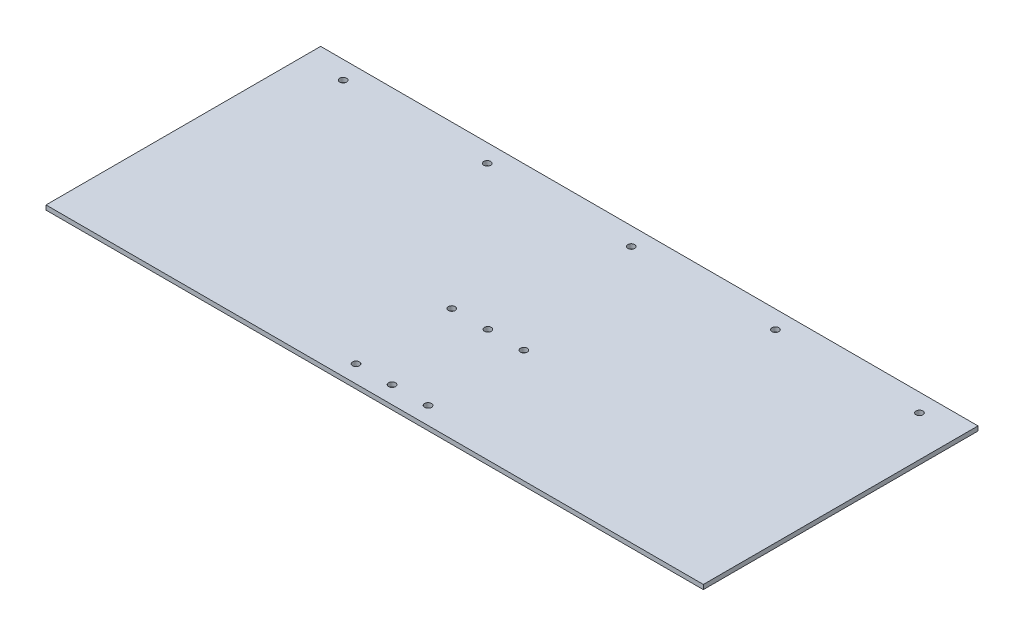
from build123d import *

# Parameters (mm, degrees)
SKETCH1_W           = 463.55
SKETCH1_H           = 193.675
SKETCH1_R           = 2.4257
BOSS_EXTRUDE1_DEPTH = 3.175


with BuildPart() as part:
    # Sketch1 → Boss-Extrude1 (new body)
    with BuildSketch(Plane(origin=(0, 0, 0), x_dir=(1, 0, 0), z_dir=(0, 1, 0))):
        with Locations((231.775, 96.8375)):
            Rectangle(SKETCH1_W, SKETCH1_H)
        with Locations(Location((231.775, 12.2555, 0), (0, 0, 270))):
            Circle(SKETCH1_R, mode=Mode.SUBTRACT)
        with Locations(Location((257.175, 12.2555, 0), (0, 0, 270))):
            Circle(SKETCH1_R, mode=Mode.SUBTRACT)
        with Locations(Location((206.375, 12.2555, 0), (0, 0, 90))):
            Circle(SKETCH1_R, mode=Mode.SUBTRACT)
        with Locations(Location((257.175, 79.8195, 0), (0, 0, 90))):
            Circle(SKETCH1_R, mode=Mode.SUBTRACT)
        with Locations(Location((231.775, 79.8195, 0), (0, 0, 90))):
            Circle(SKETCH1_R, mode=Mode.SUBTRACT)
        with Locations(Location((206.375, 79.8195, 0), (0, 0, 270))):
            Circle(SKETCH1_R, mode=Mode.SUBTRACT)
        with Locations(Location((231.775, 180.975, 0), (0, 0, 270))):
            Circle(SKETCH1_R, mode=Mode.SUBTRACT)
        with Locations(Location((333.375, 180.975, 0), (0, 0, 270))):
            Circle(SKETCH1_R, mode=Mode.SUBTRACT)
        with Locations(Location((434.975, 180.975, 0), (0, 0, 270))):
            Circle(SKETCH1_R, mode=Mode.SUBTRACT)
        with Locations(Location((28.575, 180.975, 0), (0, 0, 90))):
            Circle(SKETCH1_R, mode=Mode.SUBTRACT)
        with Locations(Location((130.175, 180.975, 0), (0, 0, 90))):
            Circle(SKETCH1_R, mode=Mode.SUBTRACT)
    extrude(amount=BOSS_EXTRUDE1_DEPTH)


solid = part.part
